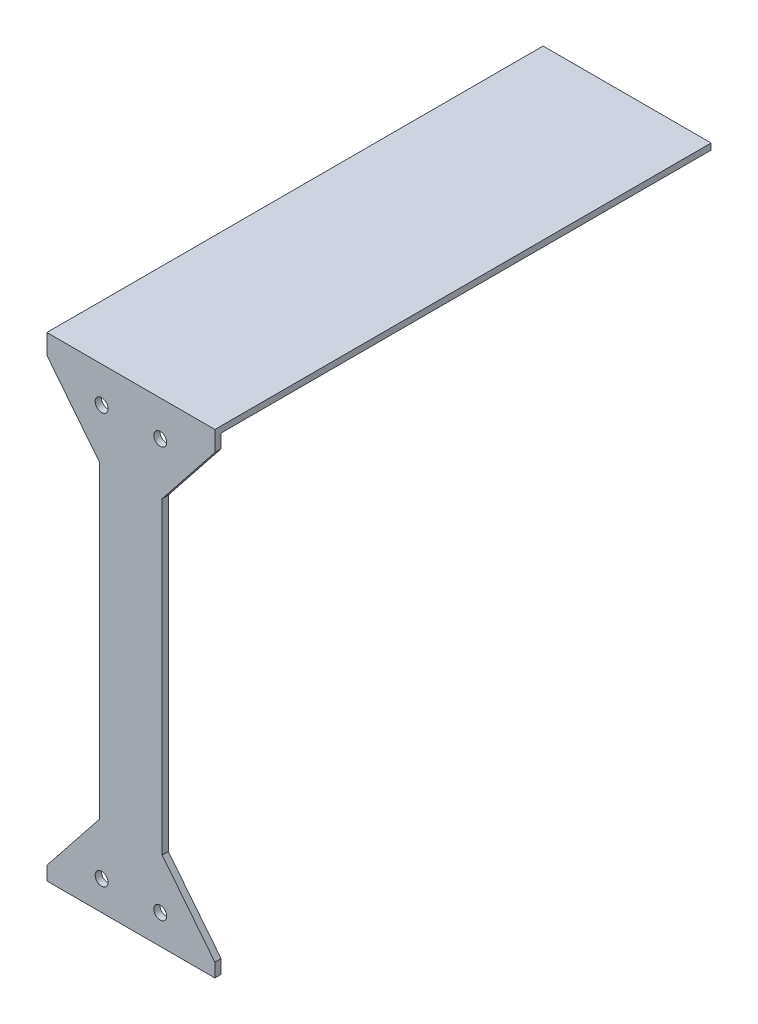
from build123d import *

# Parameters (mm, degrees)
BOSS_EXTRUDE1_DEPTH = 1.5875
SKETCH2_W           = 43
SKETCH2_H           = 127
BOSS_EXTRUDE2_DEPTH = 1.5875


with BuildPart() as part:
    # Sketch1 → Boss-Extrude1 (new body)
    with BuildSketch(Plane.XY):
        Polygon((-117, 99.5), (-103.5, 116.5), (-103.5, 120), (-146.5, 120), (-146.5, 116.5), (-133, 99.5), (-133, 20.5), (-146.5, 3.5), (-146.5, 0), (-103.5, 0), (-103.5, 3.5), (-117, 20.5), align=None)
        with BuildLine():
            ThreePointArc((-134.15, 112.5), (-132.5, 110.85), (-130.85, 112.5))
            ThreePointArc((-130.85, 112.5), (-132.5, 114.15), (-134.15, 112.5))
        make_face(mode=Mode.SUBTRACT)
        with BuildLine():
            ThreePointArc((-119.15, 112.5), (-117.5, 110.85), (-115.85, 112.5))
            ThreePointArc((-115.85, 112.5), (-117.5, 114.15), (-119.15, 112.5))
        make_face(mode=Mode.SUBTRACT)
        with BuildLine():
            ThreePointArc((-115.85, 7.5), (-117.5, 9.15), (-119.15, 7.5))
            ThreePointArc((-119.15, 7.5), (-117.5, 5.85), (-115.85, 7.5))
        make_face(mode=Mode.SUBTRACT)
        with BuildLine():
            ThreePointArc((-134.15, 7.5), (-132.5, 5.85), (-130.85, 7.5))
            ThreePointArc((-130.85, 7.5), (-132.5, 9.15), (-134.15, 7.5))
        make_face(mode=Mode.SUBTRACT)
    extrude(amount=BOSS_EXTRUDE1_DEPTH)

    # Sketch2 → Boss-Extrude2 (add)
    with BuildSketch(Plane(origin=(0, 120, 0), x_dir=(1, 0, 0), z_dir=(0, 1, 0))):
        with Locations((-125, 61.9125)):
            Rectangle(SKETCH2_W, SKETCH2_H)
    extrude(amount=BOSS_EXTRUDE2_DEPTH)


solid = part.part
